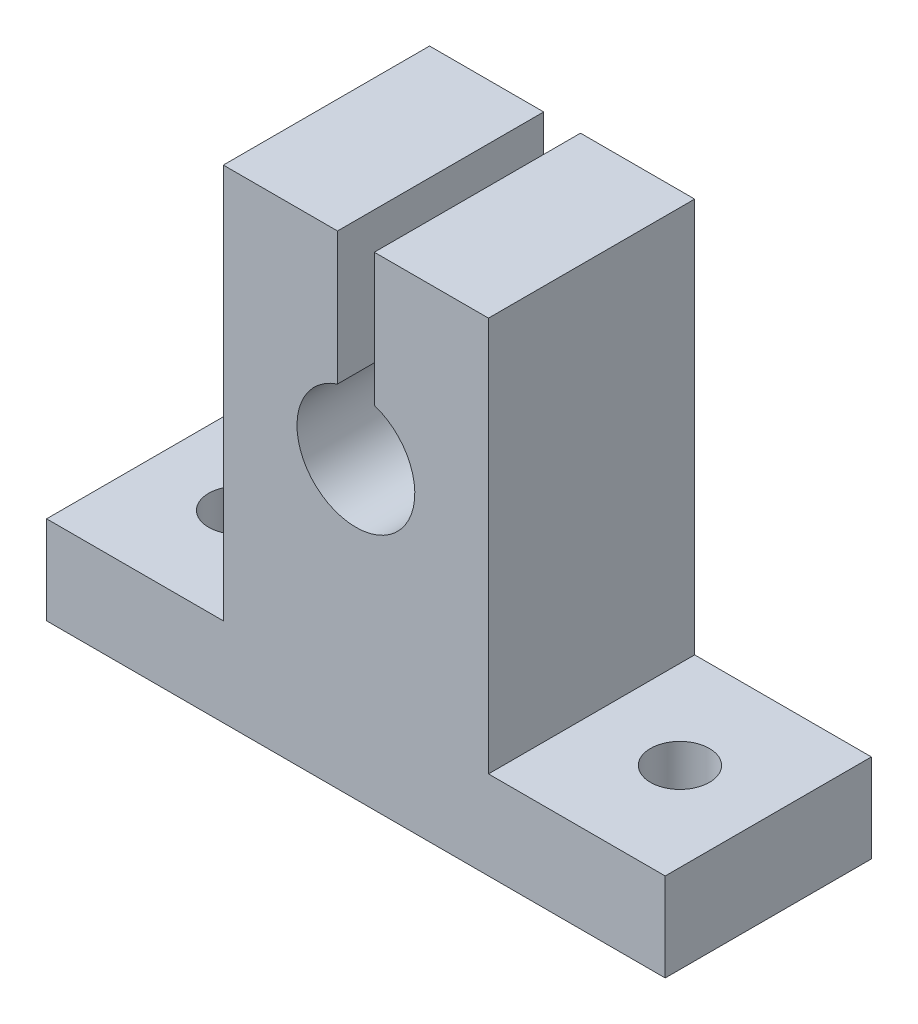
from build123d import *

# Parameters (mm, degrees)
BOSS_EXTRUDE1_DEPTH = 14
SKETCH2_R           = 2
CUT_EXTRUDE1_DEPTH  = 52.751714947


with BuildPart() as part:
    # Sketch1 → Boss-Extrude1 (new body)
    with BuildSketch(Plane.XY):
        with BuildLine():
            Line((0, 0), (42, 0))
            Line((42, 0), (42, 6))
            Line((42, 6), (30, 6))
            Line((30, 6), (30, 32.8))
            Line((30, 32.8), (22.249007882, 32.8))
            Line((22.249007882, 32.8), (22.249007882, 23.8))
            ThreePointArc((22.249007882, 23.8), (21, 15.999997414), (19.750992118, 23.8))
            Line((19.750992118, 23.8), (19.750992118, 32.8))
            Line((19.750992118, 32.8), (12, 32.8))
            Line((12, 32.8), (12, 6))
            Line((12, 6), (0, 6))
            Line((0, 6), (0, 0))
        make_face()
    extrude(amount=BOSS_EXTRUDE1_DEPTH)

    # Sketch2 → Cut-Extrude1 (cut, through all)
    with BuildSketch(Plane(origin=(0, 6, 0), x_dir=(1, 0, 0), z_dir=(0, 1, 0))):
        with Locations(Location((6, -7, 0), (0, 0, 180))):
            Circle(SKETCH2_R)
        with Locations(Location((36, -7, 0), (0, 0, 180))):
            Circle(SKETCH2_R)
    extrude(amount=-CUT_EXTRUDE1_DEPTH, mode=Mode.SUBTRACT)


solid = part.part
